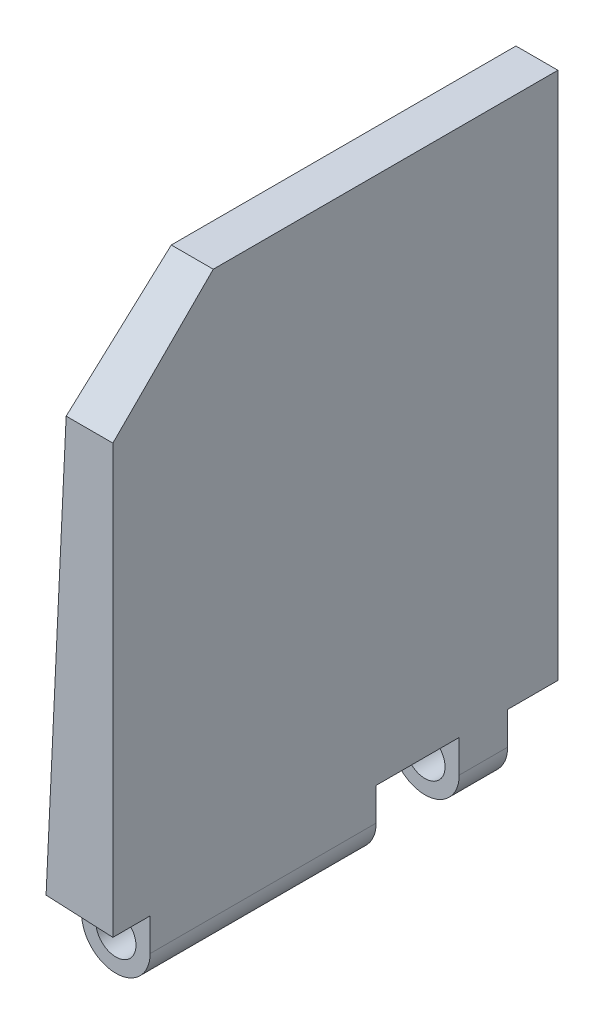
from build123d import *

# Parameters (mm, degrees)
EXTRUDE1_DEPTH     = 22.52
SKETCH2_W          = 1.884659489
SKETCH2_H          = 3.464397665
SKETCH2_W_2        = 4.20185815
SKETCH2_W_3        = 2.543185772
CUT_EXTRUDE1_DEPTH = 178.739718188
SKETCH3_R          = 1.016
CUT_EXTRUDE2_DEPTH = 179.056208827
CHAMFER1_SIZE      = 5.08


with BuildPart() as part:
    # Sketch1 → Extrude1 (new body)
    with BuildSketch(Plane.XY):
        with BuildLine():
            Line((-7.667077129, 148.378606291), (-6.328882197, 176.690074782))
            Line((-6.328882197, 176.690074782), (-4.204611232, 176.690074782))
            Line((-4.204611232, 176.690074782), (-4.204611232, 148.296821956))
            ThreePointArc((-4.204611232, 148.296821956), (-5.977713637, 146.565106133), (-7.667077129, 148.378606291))
        make_face()
    extrude(amount=-EXTRUDE1_DEPTH)

    # Sketch2 → Cut-Extrude1 (cut, through all)
    with BuildSketch(Plane(origin=(-14.647746303, 0.692353344, 0), x_dir=(0, 0, 1), z_dir=(-0.9988847890993643, 0.04721417272301316, 0))):
        with Locations((-0.942329745, 147.851138149)):
            Rectangle(SKETCH2_W, SKETCH2_H)
        with Locations((-15.423980195, 147.851138149)):
            Rectangle(SKETCH2_W_2, SKETCH2_H)
        with Locations((-21.248407114, 147.851138149)):
            Rectangle(SKETCH2_W_3, SKETCH2_H)
    extrude(amount=-CUT_EXTRUDE1_DEPTH, mode=Mode.SUBTRACT)

    # Sketch3 → Cut-Extrude2 (cut, through all)
    with BuildSketch(Plane.XY.offset(-1.884659489)):
        with Locations((-5.936810064, 148.296821956)):
            Circle(SKETCH3_R)
    extrude(amount=-CUT_EXTRUDE2_DEPTH, mode=Mode.SUBTRACT)

    # Chamfer1
    chamfer1_edges = [part.edges().sort_by_distance(p)[0] for p in [
        (-5.266746714, 176.690074782, 0),
    ]]
    chamfer(chamfer1_edges, length=CHAMFER1_SIZE)


solid = part.part
